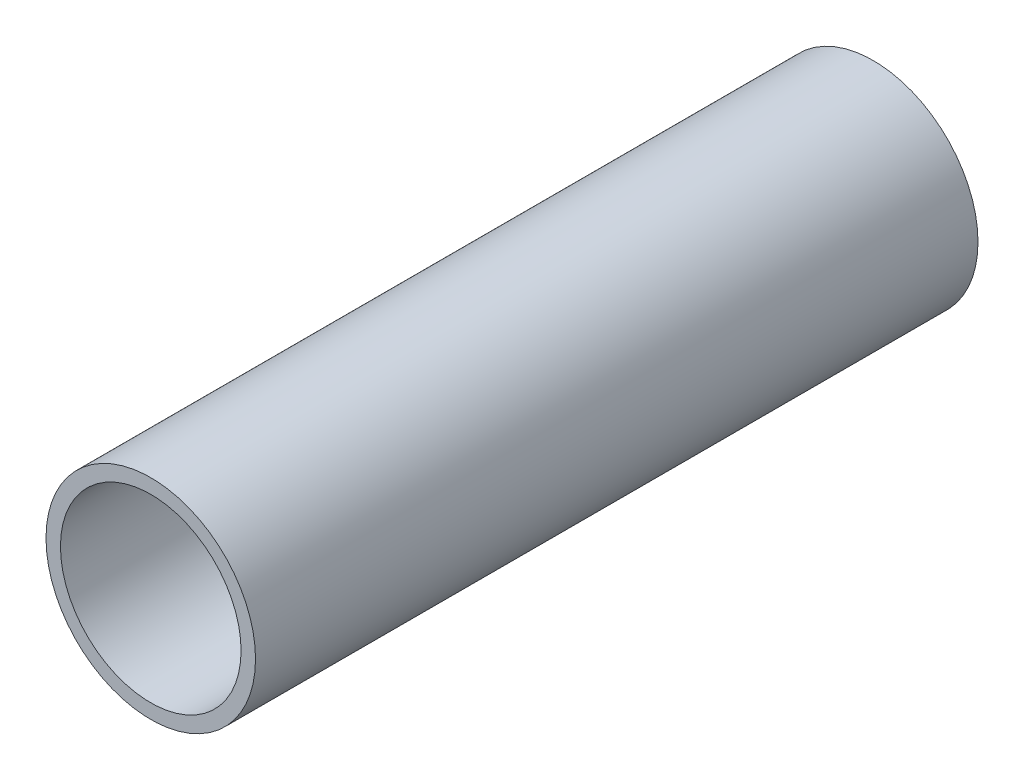
from build123d import *

# Parameters (mm, degrees)
SKETCH1_R           = 14.5
SKETCH1_R_2         = 12.5
BOSS_EXTRUDE1_DEPTH = 100


with BuildPart() as part:
    # Sketch1 → Boss-Extrude1 (new body)
    with BuildSketch(Plane.XY):
        Circle(SKETCH1_R)
        Circle(SKETCH1_R_2, mode=Mode.SUBTRACT)
    extrude(amount=BOSS_EXTRUDE1_DEPTH)


solid = part.part
